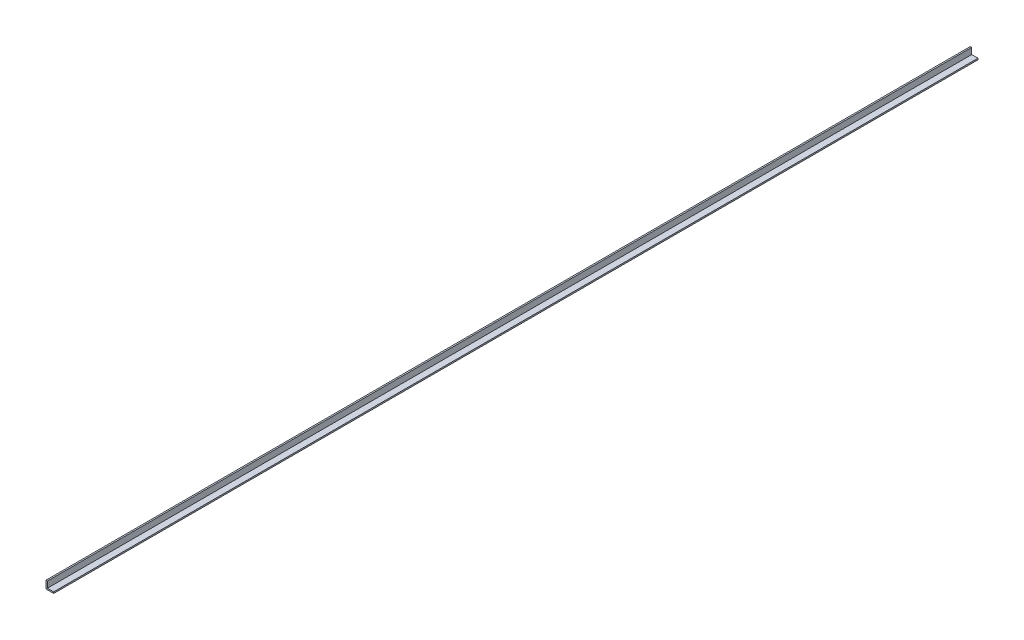
from build123d import *

# Parameters (mm, degrees)
SALIENTE_EXTRUIR1_DEPTH = 6100


with BuildPart() as part:
    # Croquis1 → Saliente-Extruir1 (new body)
    with BuildSketch(Plane.XY):
        Polygon((0, 50.8), (0, 0), (50.8, 0), (50.8, 9.53), (9.53, 9.53), (9.53, 50.8), align=None)
    extrude(amount=-SALIENTE_EXTRUIR1_DEPTH)


solid = part.part
